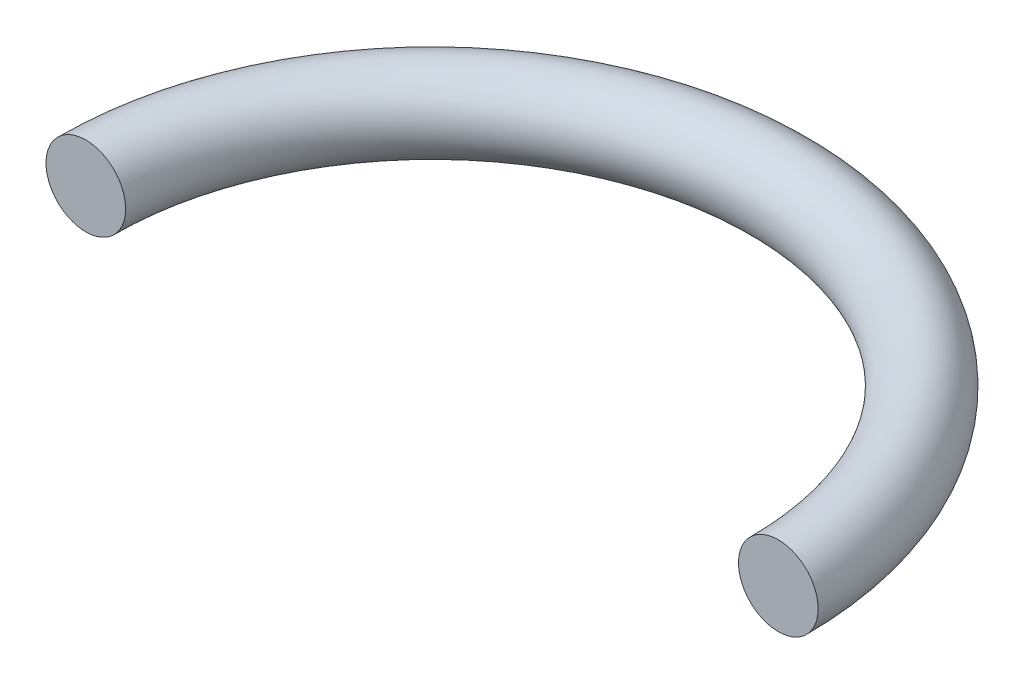
from build123d import *

# Parameters (mm, degrees)
SKETCH2_R = 14.605


with BuildPart() as part:
    # Sweep1: sweep along a path in Sketch1
    with BuildLine(Plane(origin=(0, 0, 0), x_dir=(1, 0, 0), z_dir=(0, 1, 0))) as sweep1_path:
        ThreePointArc((127, 0), (0, 127), (-127, 0))
    # Sketch2 → Sweep1 (sweep)
    with BuildSketch(Plane.XY):
        with Locations((127, 0)):
            Circle(SKETCH2_R)
    sweep(path=sweep1_path.line)


solid = part.part
